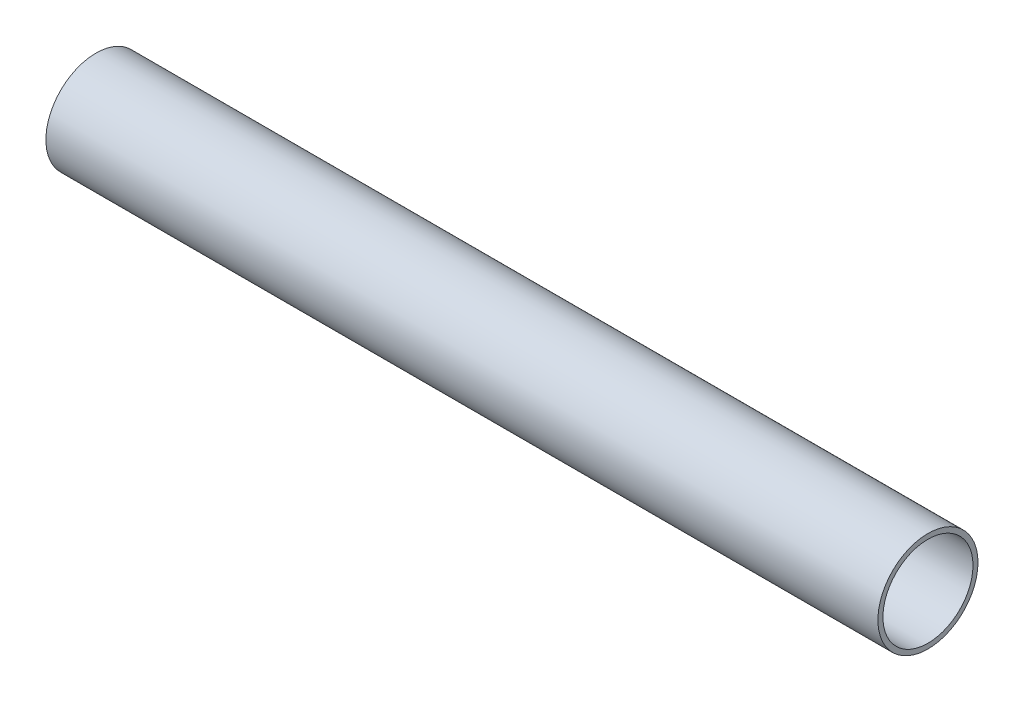
from build123d import *

# Parameters (mm, degrees)
SKETCH1_R           = 15.875
SKETCH1_R_2         = 14.2875
EXTRUDE_THIN1_DEPTH = 131.955749997


with BuildPart() as part:
    # Sketch1 → Extrude-Thin1 (new, symmetric)
    with BuildSketch(Plane(origin=(0, 0, 0), x_dir=(0, 0, -1), z_dir=(1, 0, 0))):
        Circle(SKETCH1_R)
        Circle(SKETCH1_R_2, mode=Mode.SUBTRACT)
    extrude(amount=EXTRUDE_THIN1_DEPTH, both=True)


solid = part.part
